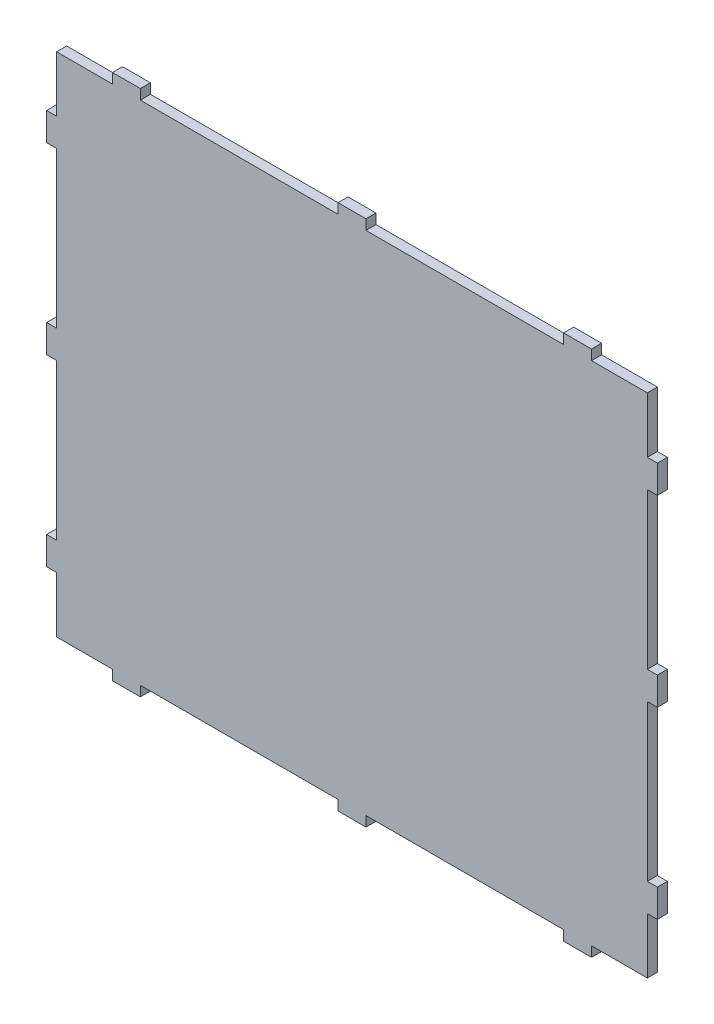
from build123d import *

# Parameters (mm, degrees)
BOSS_EXTRUDE1_DEPTH = 18


with BuildPart() as part:
    # Sketch1 → Boss-Extrude1 (new body)
    with BuildSketch(Plane.XY):
        Polygon((-961.236516538, 328.950735931), (-961.236516538, 378.950735931), (-943.236516538, 378.950735931), (-943.236516538, 657.901471863), (-961.236516538, 657.901471863), (-961.236516538, 707.901471863), (-943.236516538, 707.901471863), (-943.236516538, 807.901471863), (-843.236516538, 807.901471863), (-843.236516538, 825.901471863), (-793.236516538, 825.901471863), (-793.236516538, 807.901471863), (-439.118258269, 807.901471863), (-439.118258269, 825.901471863), (-389.118258269, 825.901471863), (-389.118258269, 807.901471863), (-35, 807.901471863), (-35, 825.901471863), (15, 825.901471863), (15, 807.901471863), (115, 807.901471863), (115, 707.901471863), (133, 707.901471863), (133, 657.901471863), (115, 657.901471863), (115, 378.950735931), (133, 378.950735931), (133, 328.950735931), (115, 328.950735931), (115, 50), (133, 50), (133, 0), (115, 0), (115, -100), (15, -100), (15, -118), (-35, -118), (-35, -100), (-389.118258269, -100), (-389.118258269, -118), (-439.118258269, -118), (-439.118258269, -100), (-793.236516538, -100), (-793.236516538, -118), (-843.236516538, -118), (-843.236516538, -100), (-943.236516538, -100), (-943.236516538, 0), (-961.236516538, 0), (-961.236516538, 50), (-943.236516538, 50), (-943.236516538, 328.950735931), align=None)
    extrude(amount=BOSS_EXTRUDE1_DEPTH)


solid = part.part
